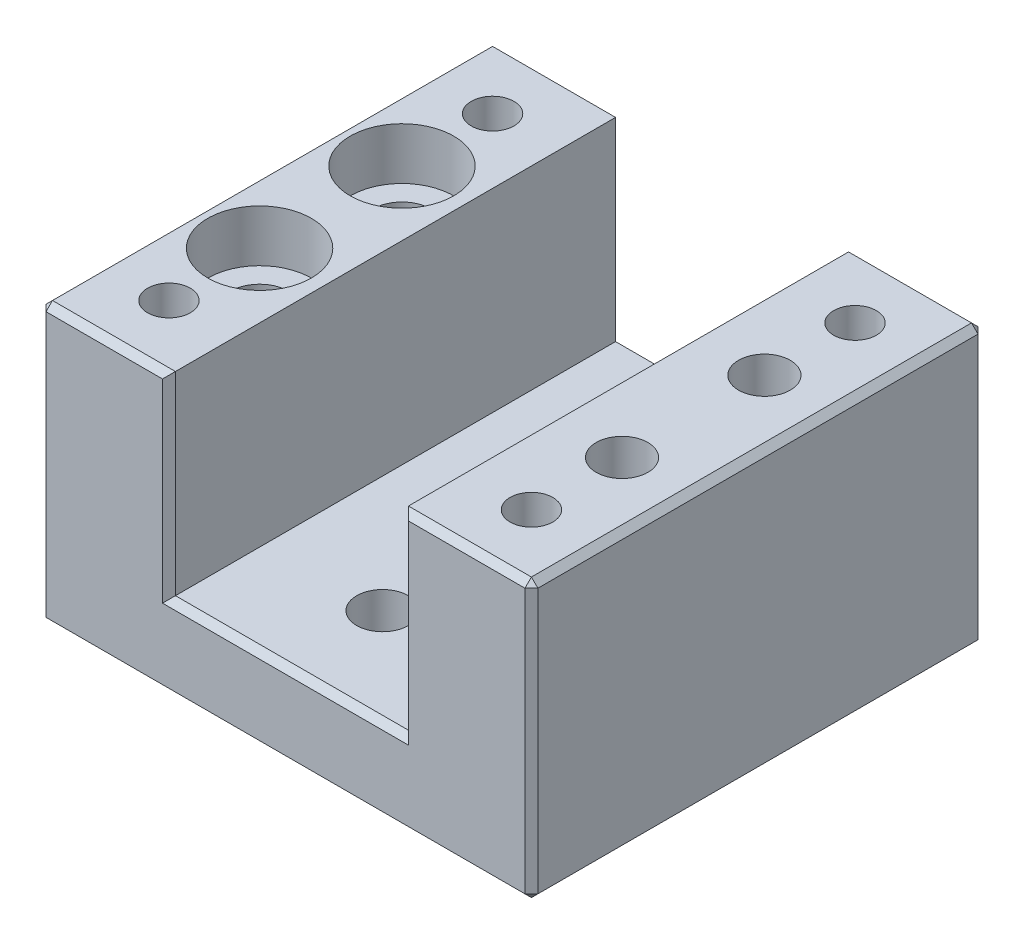
from build123d import *

# Parameters (mm, degrees)
SKETCH_1_W                   = 38
SKETCH_1_H                   = 6.45
EXTRUDE_1_DEPTH              = 35
SKETCH_2_W                   = 10
SKETCH_2_H                   = 35
EXTRUDE_2_DEPTH              = 15
HOLE_WIZARD_M4_1_D           = 4.5
HOLE_WIZARD_M4_1_CBORE_D     = 8
HOLE_WIZARD_M4_1_CBORE_DEPTH = 4
PATTERN_LINEAR_1_COUNT       = 2
PATTERN_LINEAR_1_PITCH       = 11
SKETCH_5_R                   = 2
CUT_EXTRUDE_1_DEPTH          = 54.795910625
SKETCH_6_R                   = 2
CUT_EXTRUDE_2_DEPTH          = 56.938381278
PATTERN_LINEAR_2_COUNT       = 2
PATTERN_LINEAR_2_PITCH       = 28
PATTERN_LINEAR_2_COUNT_DIR2  = 2
PATTERN_LINEAR_2_PITCH_DIR2  = 25
CHAMFER_1_SIZE               = 0.5


with BuildPart() as part:
    # 草图1 → 凸台-拉伸1 (new body)
    with BuildSketch(Plane.XY):
        with Locations((19, 3.225)):
            Rectangle(SKETCH_1_W, SKETCH_1_H)
    extrude(amount=EXTRUDE_1_DEPTH)

    # 草图2 → 凸台-拉伸2 (add)
    with BuildSketch(Plane(origin=(0, 6.45, 0), x_dir=(1, 0, 0), z_dir=(0, 1, 0))):
        with Locations((5, -17.5)):
            Rectangle(SKETCH_2_W, SKETCH_2_H)
        with Locations((33, -17.5)):
            Rectangle(SKETCH_2_W, SKETCH_2_H)
    extrude(amount=EXTRUDE_2_DEPTH)

    # Hole Wizard M4 _1 (through all)
    with Locations(Plane(origin=(0, 21.45, 0), x_dir=(-1, 0, 0), z_dir=(0, 1, 0))):
        with Locations((-5, 23)):
            hole_wizard_m4_1 = CounterBoreHole(HOLE_WIZARD_M4_1_D / 2, HOLE_WIZARD_M4_1_CBORE_D / 2, HOLE_WIZARD_M4_1_CBORE_DEPTH)

    # 阵列(线性)1: Hole Wizard M4 _1 ×2
    with Locations(*[(0, 0, -i * PATTERN_LINEAR_1_PITCH) for i in range(1, PATTERN_LINEAR_1_COUNT)]):
        add(hole_wizard_m4_1, mode=Mode.SUBTRACT)

    # 草图5 → 切除-拉伸1 (cut, through all)
    with BuildSketch(Plane(origin=(0, 6.45, 0), x_dir=(1, 0, 0), z_dir=(0, 1, 0))):
        with Locations(Location((19, -27.5, 0), (0, 0, 180))):
            Circle(SKETCH_5_R)
        with Locations(Location((19, -7.5, 0), (0, 0, 180))):
            Circle(SKETCH_5_R)
    extrude(amount=-CUT_EXTRUDE_1_DEPTH, mode=Mode.SUBTRACT)

    # 草图6 → 切除-拉伸2 (cut, through all)
    with BuildSketch(Plane(origin=(0, 21.45, 0), x_dir=(1, 0, 0), z_dir=(0, 1, 0))):
        with Locations(Location((33, -23, 0), (0, 0, 270))):
            Circle(SKETCH_6_R)
        with Locations(Location((33, -12, 0), (0, 0, 270))):
            Circle(SKETCH_6_R)
    extrude(amount=-CUT_EXTRUDE_2_DEPTH, mode=Mode.SUBTRACT)

    # 草图7 → Hole Wizard M4 _1 2 (revolve, cut)
    with BuildSketch(Plane(origin=(5, 21.45, 30), x_dir=(0, 0, 1), z_dir=(1, 0, 0))):
        Polygon((0, 0), (0, 11.091420021), (1.65, 10.1), (1.65, 0), align=None)
    hole_wizard_m4_1_2 = revolve(axis=Axis((5, 27.8, 30), (0, -1, 0)), mode=Mode.SUBTRACT)

    # 阵列(线性)2: Hole Wizard M4 _1 2 2 × 2
    with Locations(*[(i * PATTERN_LINEAR_2_PITCH, 0, -j * PATTERN_LINEAR_2_PITCH_DIR2) for i in range(PATTERN_LINEAR_2_COUNT) for j in range(PATTERN_LINEAR_2_COUNT_DIR2) if (i, j) != (0, 0)]):
        add(hole_wizard_m4_1_2, mode=Mode.SUBTRACT)

    # 倒角1
    chamfer_1_edges = [part.edges().sort_by_distance(p)[0] for p in [
        (5, 21.45, 35),
        (10, 13.95, 35),
        (19, 6.45, 0),
        (19, 6.45, 35),
        (28, 13.95, 35),
        (33, 21.45, 35),
        (19, 0, 0),
        (19, 0, 35),
        (38, 0, 17.5),
        (38, 10.725, 0),
        (38, 10.725, 35),
        (38, 21.45, 17.5),
        (33, 21.45, 0),
        (28, 13.95, 0),
        (10, 13.95, 0),
        (5, 21.45, 0),
        (0, 21.45, 17.5),
        (0, 10.725, 0),
        (0, 10.725, 35),
        (0, 0, 17.5),
    ]]
    chamfer(chamfer_1_edges, length=CHAMFER_1_SIZE)


solid = part.part
